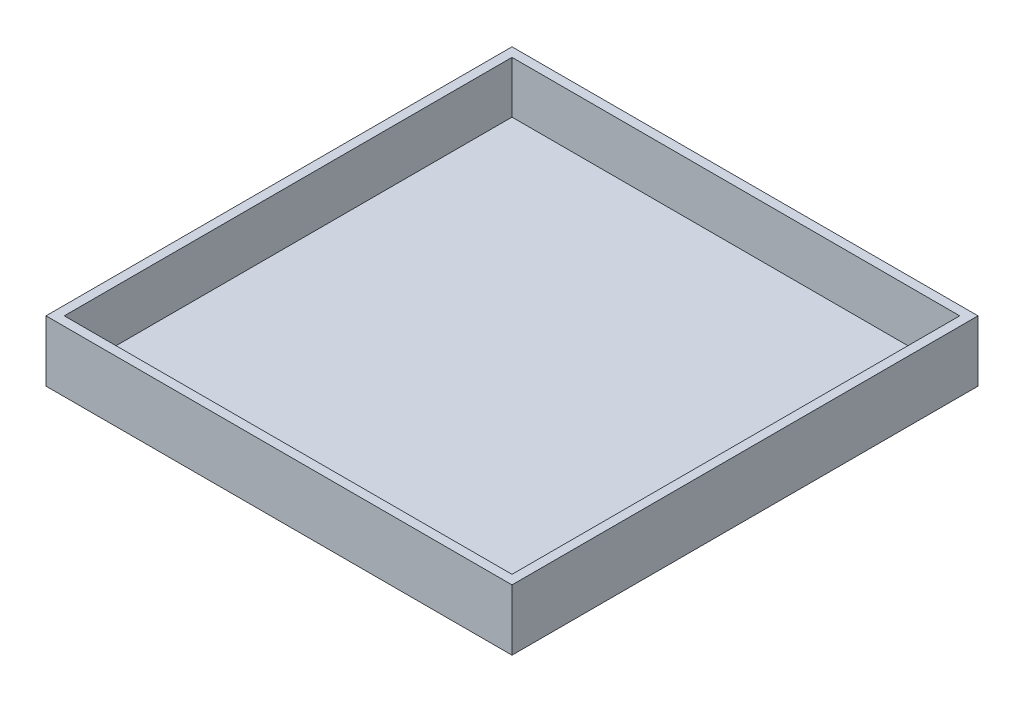
from build123d import *

# Parameters (mm, degrees)
SKETCH_1_W      = 153
SKETCH_1_H      = 153
EXTRUDE_1_DEPTH = 20
SHELL_1_T       = -3


with BuildPart() as part:
    # 草图1 → 凸台-拉伸1 (new body)
    with BuildSketch(Plane(origin=(0, 0, 0), x_dir=(1, 0, 0), z_dir=(0, 1, 0))):
        Rectangle(SKETCH_1_W, SKETCH_1_H)
    extrude(amount=EXTRUDE_1_DEPTH)

    # 抽壳1
    shell_1_openings = [part.faces().sort_by_distance(p)[0] for p in [
        (0, 20, 0),
    ]]
    offset(amount=SHELL_1_T, openings=shell_1_openings, kind=Kind.INTERSECTION)


solid = part.part
